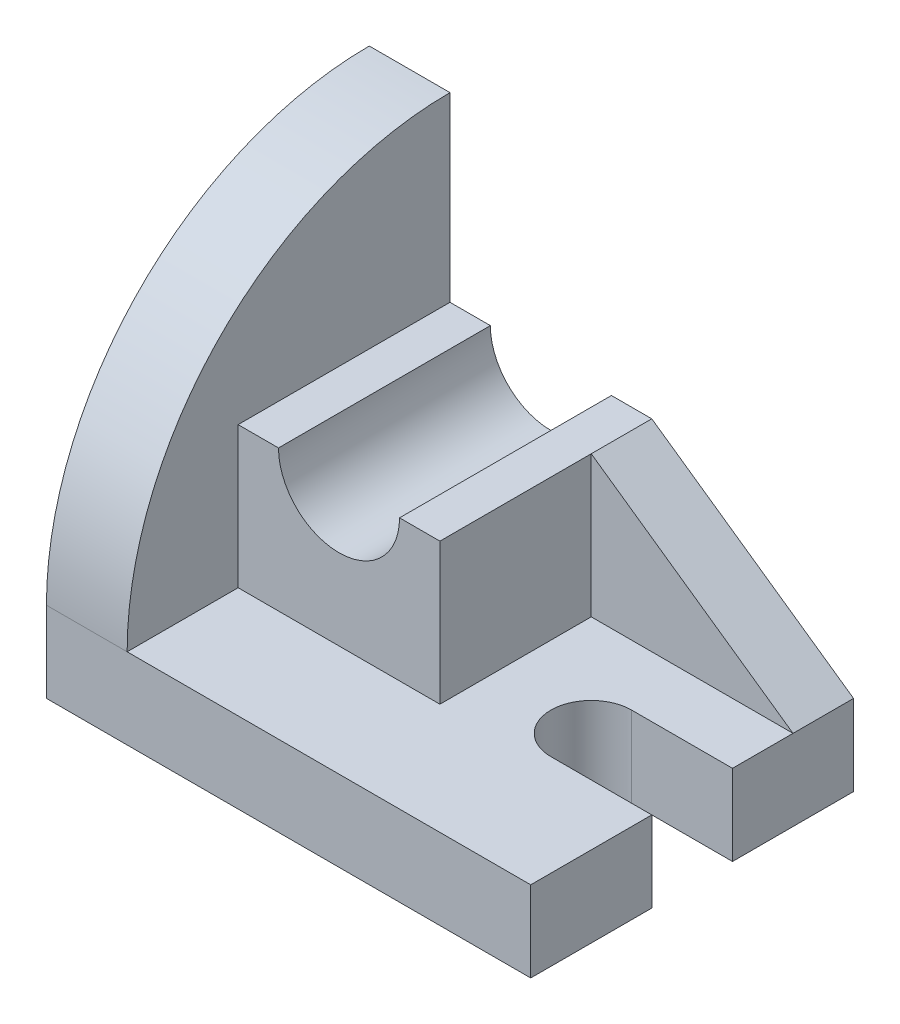
from build123d import *

# Parameters (mm, degrees)
BOSS_EXTRUDE1_DEPTH     = 40.64
BOSS_EXTRUDE2_DEPTH     = 40.64
SKETCH3_W               = 101.6
SKETCH3_H               = 106.68
BOSS_EXTRUDE3_DEPTH     = 71.12
CUT_EXTRUDE1_DEPTH      = 260.875641029
CUT_EXTRUDE1_DEPTH_BACK = 260.875641029
SKETCH5_W               = 101.6
SKETCH5_H               = 30.48
BOSS_EXTRUDE4_DEPTH     = 71.12
CUT_EXTRUDE2_DEPTH      = 71.12


with BuildPart() as part:
    # Sketch1 → Boss-Extrude1 (new body)
    with BuildSketch(Plane(origin=(0, 0, 0), x_dir=(1, 0, 0), z_dir=(0, 1, 0))):
        with BuildLine():
            Line((-121.92, -81.28), (121.92, -81.28))
            Line((121.92, -81.28), (121.92, -20.32))
            Line((121.92, -20.32), (71.12, -20.32))
            ThreePointArc((71.12, -20.32), (50.8, 0), (71.12, 20.32))
            Line((71.12, 20.32), (121.92, 20.32))
            Line((121.92, 20.32), (121.92, 81.28))
            Line((121.92, 81.28), (-121.92, 81.28))
            Line((-121.92, 81.28), (-121.92, -81.28))
        make_face()
    extrude(amount=BOSS_EXTRUDE1_DEPTH)

    # Sketch2 → Boss-Extrude2 (add)
    with BuildSketch(Plane.ZY.offset(121.92)):
        with BuildLine():
            Line((-81.28, 40.64), (-81.28, 203.2))
            ThreePointArc((-81.28, 203.2), (33.66727835, 155.58727835), (81.28, 40.64))
            Line((81.28, 40.64), (-81.28, 40.64))
        make_face()
    extrude(amount=-BOSS_EXTRUDE2_DEPTH)

    # Sketch3 → Boss-Extrude3 (add)
    with BuildSketch(Plane(origin=(0, 40.64, 0), x_dir=(1, 0, 0), z_dir=(0, 1, 0))):
        with Locations((-30.48, 27.94)):
            Rectangle(SKETCH3_W, SKETCH3_H)
    extrude(amount=BOSS_EXTRUDE3_DEPTH)

    # Sketch4 → Cut-Extrude1 (cut, two sides: drawn at the far end of the back side and taken through both)
    with BuildSketch(Plane.XY.offset(25.4).offset(-CUT_EXTRUDE1_DEPTH_BACK)):
        with BuildLine():
            Line((-60.96, 111.76), (0, 111.76))
            ThreePointArc((0, 111.76), (-30.48, 81.28), (-60.96, 111.76))
        make_face()
    extrude(amount=CUT_EXTRUDE1_DEPTH + CUT_EXTRUDE1_DEPTH_BACK, mode=Mode.SUBTRACT)

    # Sketch5 → Boss-Extrude4 (add)
    with BuildSketch(Plane(origin=(0, 40.64, 0), x_dir=(1, 0, 0), z_dir=(0, 1, 0))):
        with Locations((71.12, 66.04)):
            Rectangle(SKETCH5_W, SKETCH5_H)
    extrude(amount=BOSS_EXTRUDE4_DEPTH)

    # Sketch6 → Cut-Extrude2 (cut)
    with BuildSketch(Plane.XY.offset(-50.8)):
        Polygon((20.32, 111.76), (121.92, 40.64), (121.92, 111.76), align=None)
    extrude(amount=-CUT_EXTRUDE2_DEPTH, mode=Mode.SUBTRACT)


solid = part.part
